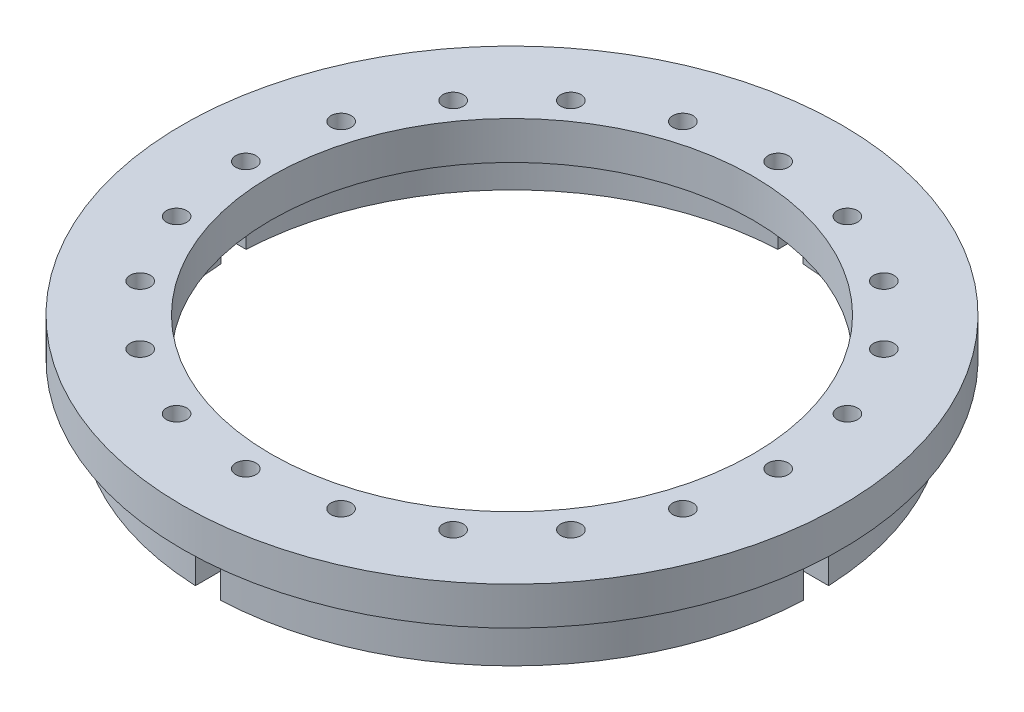
from build123d import *

# Parameters (mm, degrees)
SKETCH1_R           = 13
SKETCH1_R_2         = 9.5
SKETCH1_R_3         = 0.4
BOSS_EXTRUDE1_DEPTH = 1.5
BOSS_EXTRUDE2_DEPTH = 2


with BuildPart() as part:
    # Sketch1 → Boss-Extrude1 (new body)
    with BuildSketch(Plane(origin=(0, 0, 0), x_dir=(1, 0, 0), z_dir=(0, 1, 0))):
        with Locations(Location((0, 0, 0), (0, 0, 270))):
            Circle(SKETCH1_R)
        with Locations(Location((0, 0, 0), (0, 0, 270))):
            Circle(SKETCH1_R_2, mode=Mode.SUBTRACT)
        with Locations(Location((10.5, 0, 0), (0, 0, 270))):
            Circle(SKETCH1_R_3, mode=Mode.SUBTRACT)
        with Locations(Location((9.986093421, -3.244678441, 0), (0, 0, 270))):
            Circle(SKETCH1_R_3, mode=Mode.SUBTRACT)
        with Locations(Location((8.494678441, -6.171745149, 0), (0, 0, 270))):
            Circle(SKETCH1_R_3, mode=Mode.SUBTRACT)
        with Locations(Location((6.171745149, -8.494678441, 0), (0, 0, 270))):
            Circle(SKETCH1_R_3, mode=Mode.SUBTRACT)
        with Locations(Location((3.244678441, -9.986093421, 0), (0, 0, 270))):
            Circle(SKETCH1_R_3, mode=Mode.SUBTRACT)
        with Locations(Location((0, -10.5, 0), (0, 0, 270))):
            Circle(SKETCH1_R_3, mode=Mode.SUBTRACT)
        with Locations(Location((-3.244678441, -9.986093421, 0), (0, 0, 270))):
            Circle(SKETCH1_R_3, mode=Mode.SUBTRACT)
        with Locations(Location((-6.171745149, -8.494678441, 0), (0, 0, 270))):
            Circle(SKETCH1_R_3, mode=Mode.SUBTRACT)
        with Locations(Location((-8.494678441, -6.171745149, 0), (0, 0, 270))):
            Circle(SKETCH1_R_3, mode=Mode.SUBTRACT)
        with Locations(Location((-9.986093421, -3.244678441, 0), (0, 0, 270))):
            Circle(SKETCH1_R_3, mode=Mode.SUBTRACT)
        with Locations(Location((-10.5, 0, 0), (0, 0, 270))):
            Circle(SKETCH1_R_3, mode=Mode.SUBTRACT)
        with Locations(Location((-9.986093421, 3.244678441, 0), (0, 0, 270))):
            Circle(SKETCH1_R_3, mode=Mode.SUBTRACT)
        with Locations(Location((-8.494678441, 6.171745149, 0), (0, 0, 270))):
            Circle(SKETCH1_R_3, mode=Mode.SUBTRACT)
        with Locations(Location((-6.171745149, 8.494678441, 0), (0, 0, 270))):
            Circle(SKETCH1_R_3, mode=Mode.SUBTRACT)
        with Locations(Location((-3.244678441, 9.986093421, 0), (0, 0, 270))):
            Circle(SKETCH1_R_3, mode=Mode.SUBTRACT)
        with Locations(Location((0, 10.5, 0), (0, 0, 270))):
            Circle(SKETCH1_R_3, mode=Mode.SUBTRACT)
        with Locations(Location((3.244678441, 9.986093421, 0), (0, 0, 270))):
            Circle(SKETCH1_R_3, mode=Mode.SUBTRACT)
        with Locations(Location((6.171745149, 8.494678441, 0), (0, 0, 270))):
            Circle(SKETCH1_R_3, mode=Mode.SUBTRACT)
        with Locations(Location((8.494678441, 6.171745149, 0), (0, 0, 270))):
            Circle(SKETCH1_R_3, mode=Mode.SUBTRACT)
        with Locations(Location((9.986093421, 3.244678441, 0), (0, 0, 270))):
            Circle(SKETCH1_R_3, mode=Mode.SUBTRACT)
    extrude(amount=BOSS_EXTRUDE1_DEPTH)

    # Sketch2 → Boss-Extrude2 (add)
    with BuildSketch(Plane(origin=(0, 0, 0), x_dir=(1, 0, 0), z_dir=(0, 1, 0))):
        with BuildLine():
            Line((11.989578808, 0.5), (10.988630488, 0.5))
            ThreePointArc((10.988630488, 0.5), (7.778174593, 7.778174593), (0.5, 10.988630488))
            Line((0.5, 10.988630488), (0.5, 11.989578808))
            ThreePointArc((0.5, 11.989578808), (8.485281374, 8.485281374), (11.989578808, 0.5))
        make_face()
        with BuildLine():
            Line((11.989578808, -0.5), (10.988630488, -0.5))
            ThreePointArc((10.988630488, -0.5), (7.778174593, -7.778174593), (0.5, -10.988630488))
            Line((0.5, -10.988630488), (0.5, -11.989578808))
            ThreePointArc((0.5, -11.989578808), (8.485281374, -8.485281374), (11.989578808, -0.5))
        make_face()
        with BuildLine():
            Line((-0.5, -11.989578808), (-0.5, -10.988630488))
            ThreePointArc((-0.5, -10.988630488), (-7.778174593, -7.778174593), (-10.988630488, -0.5))
            Line((-10.988630488, -0.5), (-11.989578808, -0.5))
            ThreePointArc((-11.989578808, -0.5), (-8.485281374, -8.485281374), (-0.5, -11.989578808))
        make_face()
        with BuildLine():
            Line((-0.5, 10.988630488), (-0.5, 11.989578808))
            ThreePointArc((-0.5, 11.989578808), (-8.485281374, 8.485281374), (-11.989578808, 0.5))
            Line((-11.989578808, 0.5), (-10.988630488, 0.5))
            ThreePointArc((-10.988630488, 0.5), (-7.778174593, 7.778174593), (-0.5, 10.988630488))
        make_face()
    extrude(amount=-BOSS_EXTRUDE2_DEPTH)


solid = part.part
